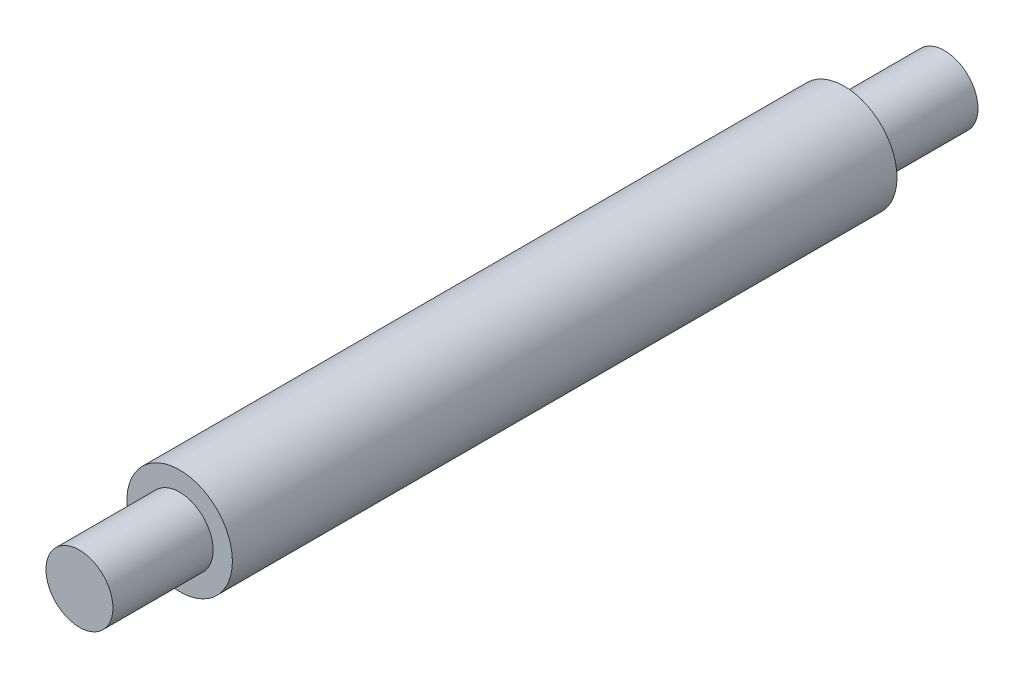
from build123d import *

# Parameters (mm, degrees)
SKETCH1_R           = 3.175
BOSS_EXTRUDE1_DEPTH = 41
SKETCH2_R           = 5
BOSS_EXTRUDE2_DEPTH = 31.5


with BuildPart() as part:
    # Sketch1 → Boss-Extrude1 (new, symmetric)
    with BuildSketch(Plane.XY):
        Circle(SKETCH1_R)
    extrude(amount=BOSS_EXTRUDE1_DEPTH, both=True)


with BuildPart() as body_2:
    # Sketch2 → Boss-Extrude2 (new, symmetric)
    with BuildSketch(Plane.XY):
        Circle(SKETCH2_R)
    extrude(amount=BOSS_EXTRUDE2_DEPTH, both=True)


solid = Compound([part.part, body_2.part])
